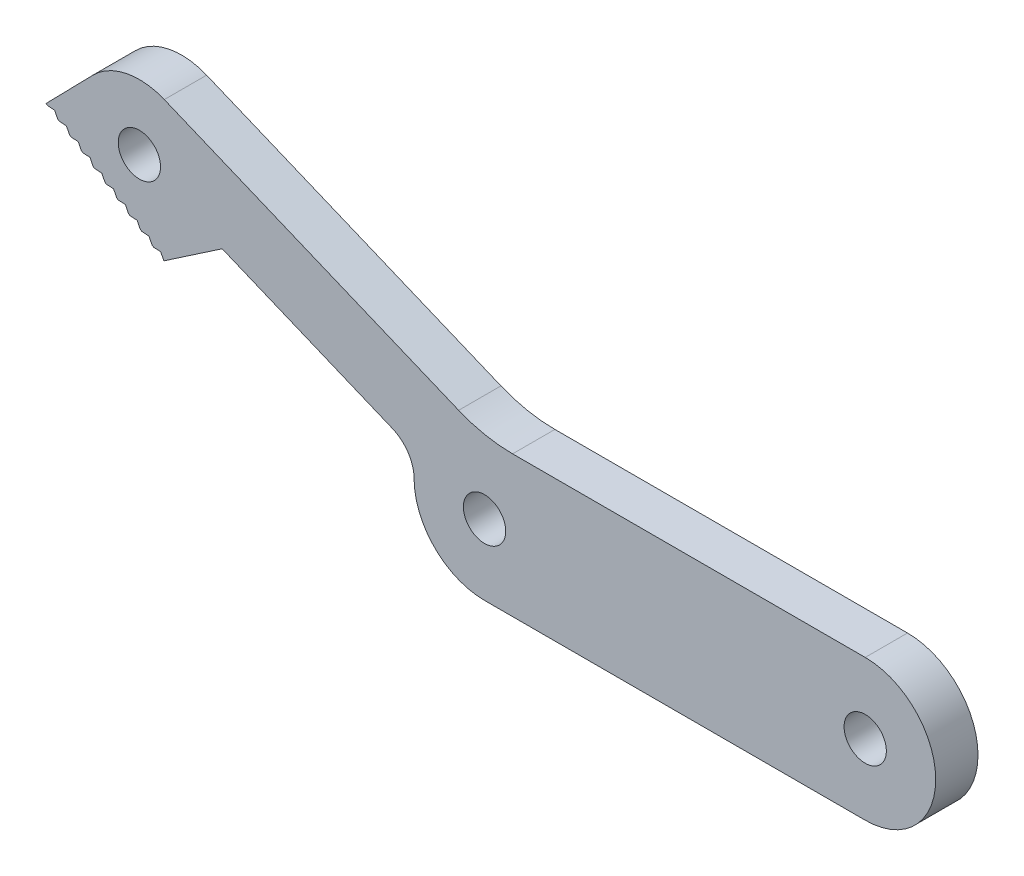
from build123d import *

# Parameters (mm, degrees)
SKETCH1_R            = 1.5
BOSS_EXTRUDE1_DEPTH  = 3
CUT_EXTRUDE1_DEPTH   = 23
LPATTERN1_COUNT      = 2
LPATTERN1_PITCH      = 10
LPATTERN1_COUNT_DIR2 = 10
LPATTERN1_PITCH_DIR2 = 1


with BuildPart() as part:
    # Sketch1 → Boss-Extrude1 (new body)
    with BuildSketch(Plane.XY):
        with BuildLine():
            Line((-11.510876326, 5), (13.5, 5))
            ThreePointArc((13.5, 5), (18.5, 0), (13.5, -5))
            Line((13.5, -5), (-13.5, -5))
            ThreePointArc((-13.5, -5), (-17.032859244, -3.538206546), (-18.499994281, -0.007562225))
            ThreePointArc((-18.499994281, -0.007562225), (-18.922368323, 1.379153788), (-20.043282841, 2.298355494))
            Line((-20.043282841, 2.298355494), (-32.109838269, 7.296486403))
            Line((-32.109838269, 7.296486403), (-36.245393033, 4.48629303))
            Line((-36.245393033, 4.48629303), (-44.606456533, 9.97196684))
            Line((-44.606456533, 9.97196684), (-41.286860538, 13.369433901))
            ThreePointArc((-41.286860538, 13.369433901), (-38.910252818, 14.666448531), (-36.215040659, 14.408877911))
            Line((-36.215040659, 14.408877911), (-15.33771065, 5.761204675))
            ThreePointArc((-15.33771065, 5.761204675), (-13.461779546, 5.192147196), (-11.510876326, 5))
        make_face()
        with Locations((-13.5, 0)):
            Circle(SKETCH1_R, mode=Mode.SUBTRACT)
        with Locations((13.5, 0)):
            Circle(SKETCH1_R, mode=Mode.SUBTRACT)
        with Locations((-37.982807612, 10.141110958)):
            Circle(SKETCH1_R, mode=Mode.SUBTRACT)
    extrude(amount=BOSS_EXTRUDE1_DEPTH)

    # Sketch3 → Cut-Extrude1 (cut)
    with BuildSketch(Plane.XY.offset(3)):
        Polygon((-36.470295857, 4.932856261), (-36.969482372, 4.961366317), (-36.245393033, 4.48629303), align=None)
    cut_extrude1 = extrude(amount=-CUT_EXTRUDE1_DEPTH, mode=Mode.SUBTRACT)

    # LPattern1: Cut-Extrude1 2 × 10
    with Locations(*[Vector(-0.8361063499961565, 0.5485673809990023, 0) * (i * LPATTERN1_PITCH) + Vector(0.8361063499961561, -0.548567380999003, 0) * (j * LPATTERN1_PITCH_DIR2) for i in range(LPATTERN1_COUNT) for j in range(LPATTERN1_COUNT_DIR2) if (i, j) != (0, 0)]):
        add(cut_extrude1, mode=Mode.SUBTRACT)


solid = part.part
